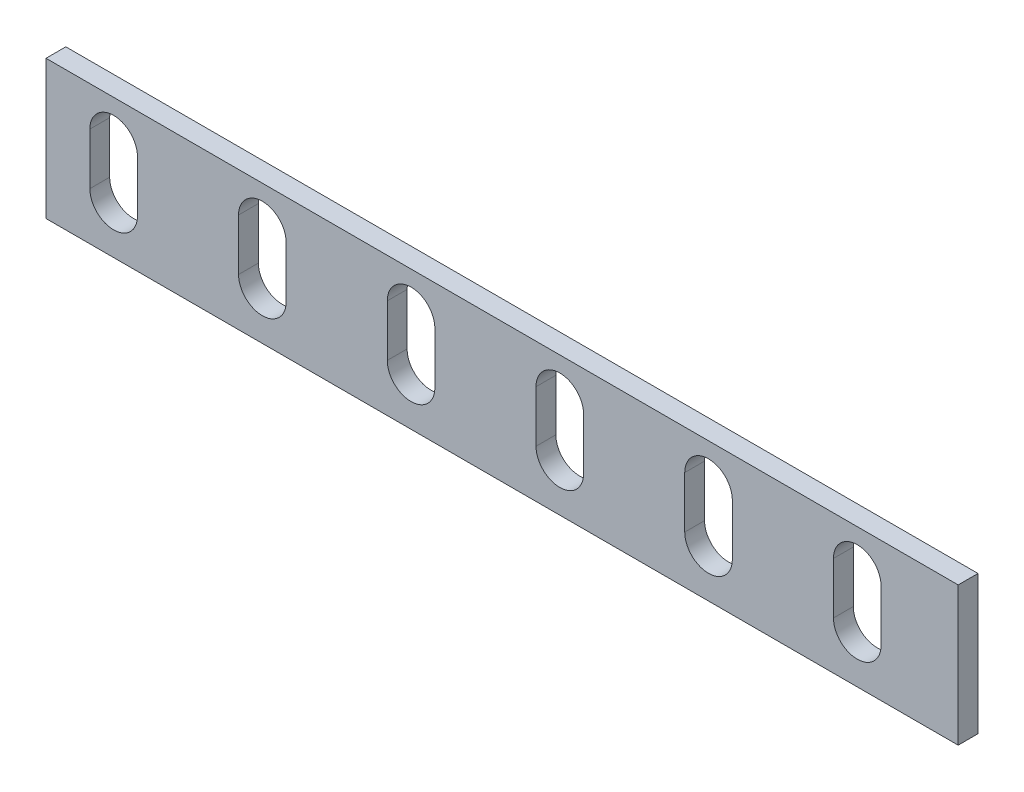
from build123d import *

# Parameters (mm, degrees)
SKETCH1_W           = 920
SKETCH1_H           = 140
BOSS_EXTRUDE1_DEPTH = 20


with BuildPart() as part:
    # Sketch1 → Boss-Extrude1 (new body)
    with BuildSketch(Plane.XY):
        with Locations((9.62605042, 42.521008403)):
            Rectangle(SKETCH1_W, SKETCH1_H)
        with BuildLine():
            Line((-358.161990974, 72.74106151), (-358.161990974, 20.74106151))
            ThreePointArc((-358.161990974, 20.74106151), (-382.161990974, -3.25893849), (-406.161990974, 20.74106151))
            Line((-406.161990974, 20.74106151), (-406.161990974, 72.74106151))
            ThreePointArc((-406.161990974, 72.74106151), (-382.161990974, 96.74106151), (-358.161990974, 72.74106151))
        make_face(mode=Mode.SUBTRACT)
        with BuildLine():
            Line((-208.161990974, 72.74106151), (-208.161990974, 20.74106151))
            ThreePointArc((-208.161990974, 20.74106151), (-232.161990974, -3.25893849), (-256.161990974, 20.74106151))
            Line((-256.161990974, 20.74106151), (-256.161990974, 72.74106151))
            ThreePointArc((-256.161990974, 72.74106151), (-232.161990974, 96.74106151), (-208.161990974, 72.74106151))
        make_face(mode=Mode.SUBTRACT)
        with BuildLine():
            Line((-58.161990974, 72.74106151), (-58.161990974, 20.74106151))
            ThreePointArc((-58.161990974, 20.74106151), (-82.161990974, -3.25893849), (-106.161990974, 20.74106151))
            Line((-106.161990974, 20.74106151), (-106.161990974, 72.74106151))
            ThreePointArc((-106.161990974, 72.74106151), (-82.161990974, 96.74106151), (-58.161990974, 72.74106151))
        make_face(mode=Mode.SUBTRACT)
        with BuildLine():
            Line((91.838009026, 72.74106151), (91.838009026, 20.74106151))
            ThreePointArc((91.838009026, 20.74106151), (67.838009026, -3.25893849), (43.838009026, 20.74106151))
            Line((43.838009026, 20.74106151), (43.838009026, 72.74106151))
            ThreePointArc((43.838009026, 72.74106151), (67.838009026, 96.74106151), (91.838009026, 72.74106151))
        make_face(mode=Mode.SUBTRACT)
        with BuildLine():
            Line((241.838009026, 72.74106151), (241.838009026, 20.74106151))
            ThreePointArc((241.838009026, 20.74106151), (217.838009026, -3.25893849), (193.838009026, 20.74106151))
            Line((193.838009026, 20.74106151), (193.838009026, 72.74106151))
            ThreePointArc((193.838009026, 72.74106151), (217.838009026, 96.74106151), (241.838009026, 72.74106151))
        make_face(mode=Mode.SUBTRACT)
        with BuildLine():
            Line((391.838009026, 72.74106151), (391.838009026, 20.74106151))
            ThreePointArc((391.838009026, 20.74106151), (367.838009026, -3.25893849), (343.838009026, 20.74106151))
            Line((343.838009026, 20.74106151), (343.838009026, 72.74106151))
            ThreePointArc((343.838009026, 72.74106151), (367.838009026, 96.74106151), (391.838009026, 72.74106151))
        make_face(mode=Mode.SUBTRACT)
    extrude(amount=BOSS_EXTRUDE1_DEPTH)


solid = part.part
